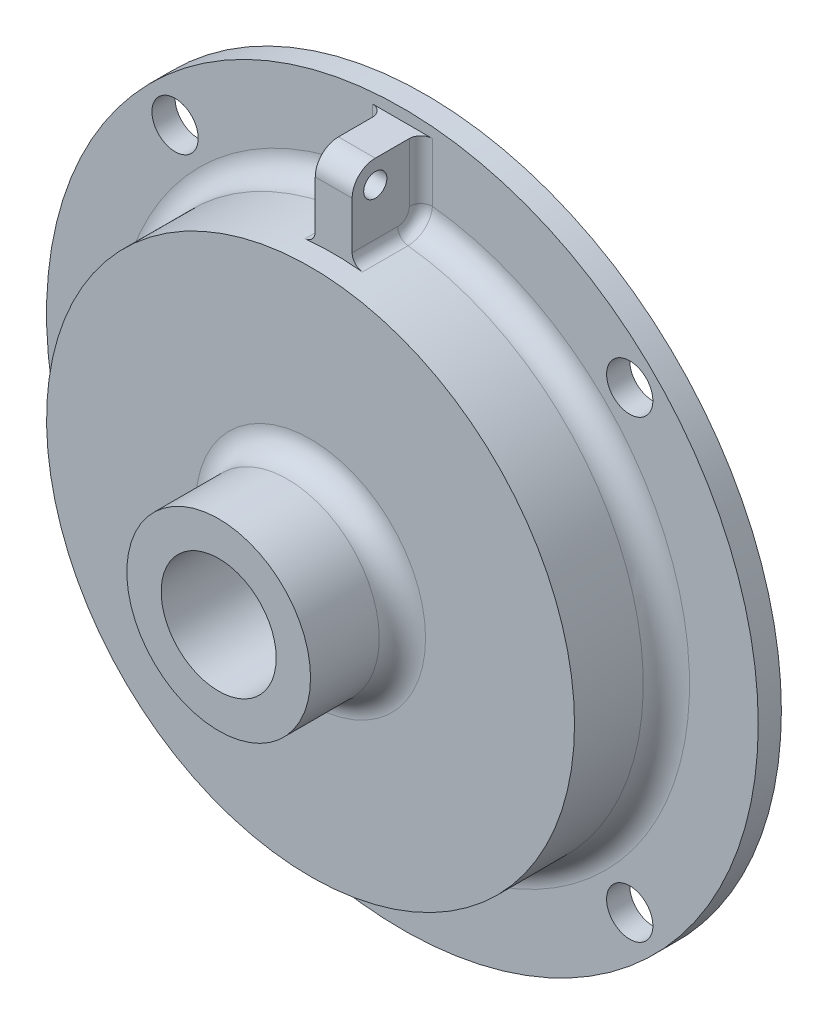
from build123d import *

# Parameters (mm, degrees)
SKETCH1_R           = 49.2
BASE_EXTRUDE_DEPTH  = 3.2
SKETCH5_R           = 3.2
CUT_EXTRUDE2_DEPTH  = 70.652853495
CIRPATTERN1_COUNT   = 4
SKETCH2_R           = 36.5
BOSS_EXTRUDE1_DEPTH = 12.7
SKETCH3_R           = 12.7
BOSS_EXTRUDE2_DEPTH = 12.7
FILLET1_R           = 3.2
SKETCH6_W           = 5.1
SKETCH6_H           = 9.5
BOSS_EXTRUDE3_DEPTH = 47.6
SKETCH4_R           = 7.95
CUT_EXTRUDE1_DEPTH  = 76.227920349
FILLET2_R           = 3.2
CUT_EXTRUDE3_REACH  = 78.92
SKETCH7_R           = 1.6
FILLET3_R           = 1.6


with BuildPart() as part:
    # Sketch1 → Base-Extrude (new body)
    with BuildSketch(Plane.XY):
        Circle(SKETCH1_R)
    extrude(amount=BASE_EXTRUDE_DEPTH)

    # Sketch5 → Cut-Extrude2 (cut, through all)
    with BuildSketch(Plane.XY.offset(3.2)):
        with Locations((31.430896424, 31.430896424)):
            Circle(SKETCH5_R)
    cut_extrude2 = extrude(amount=-CUT_EXTRUDE2_DEPTH, mode=Mode.SUBTRACT)

    # CirPattern1: Cut-Extrude2 ×4 about axis
    cirpattern1_axis = Axis((0, 0, 0), (0, 0, 1))
    for i in range(1, CIRPATTERN1_COUNT):
        add(cut_extrude2.rotate(cirpattern1_axis, i * 360 / CIRPATTERN1_COUNT), mode=Mode.SUBTRACT)

    # Sketch2 → Boss-Extrude1 (add)
    with BuildSketch(Plane.XY.offset(3.2)):
        Circle(SKETCH2_R)
    extrude(amount=BOSS_EXTRUDE1_DEPTH)

    # Sketch3 → Boss-Extrude2 (add)
    with BuildSketch(Plane.XY.offset(15.9)):
        Circle(SKETCH3_R)
    extrude(amount=BOSS_EXTRUDE2_DEPTH)

    # Fillet1
    fillet1_edges = [part.edges().sort_by_distance(p)[0] for p in [
        (-36.5, 0, 3.2),
        (-12.7, 0, 15.9),
    ]]
    fillet(fillet1_edges, radius=FILLET1_R)

    # Sketch6 → Boss-Extrude3 (add)
    with BuildSketch(Plane(origin=(0, 0, 0), x_dir=(1, 0, 0), z_dir=(0, 1, 0))):
        with Locations((0, -7.95)):
            Rectangle(SKETCH6_W, SKETCH6_H)
    extrude(amount=BOSS_EXTRUDE3_DEPTH)

    # Sketch4 → Cut-Extrude1 (cut, through all)
    with BuildSketch(Plane.XY.offset(28.6)):
        Circle(SKETCH4_R)
    extrude(amount=-CUT_EXTRUDE1_DEPTH, mode=Mode.SUBTRACT)

    # Fillet2
    fillet2_edges = [part.edges().sort_by_distance(p)[0] for p in [
        (0, 47.6, 12.7),
    ]]
    fillet(fillet2_edges, radius=FILLET2_R)

    # Sketch7 → Cut-Extrude3 (cut, up to next)
    with BuildSketch(Plane(origin=(2.55, 0, 0), x_dir=(0, 0, -1), z_dir=(1, 0, 0)), mode=Mode.PRIVATE) as cut_extrude3_sk1:
        with Locations((-9.5, 44.4)):
            Circle(SKETCH7_R)
    cut_extrude3_tool1 = extrude(cut_extrude3_sk1.sketch, amount=-CUT_EXTRUDE3_REACH, mode=Mode.PRIVATE) & part.part
    add(cut_extrude3_tool1.solids().sort_by_distance((2.55, 44.4, 9.5))[0], mode=Mode.SUBTRACT)

    # Fillet3
    fillet3_edges = [part.edges().sort_by_distance(p)[0] for p in [
        (2.55, 43.609009945, 3.2),
        (-2.55, 36.410815701, 9.5499997),
        (-2.55, 43.609009945, 3.2),
        (2.55, 36.410815701, 9.5499997),
    ]]
    fillet(fillet3_edges, radius=FILLET3_R)


solid = part.part
